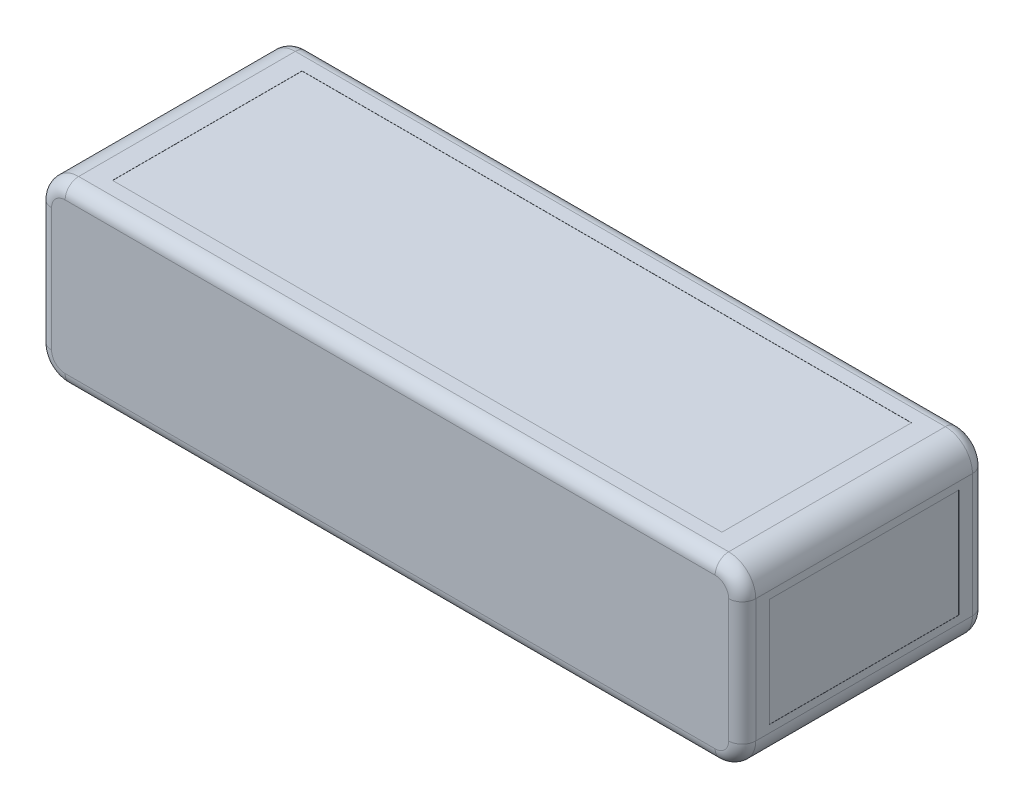
from build123d import *

# Parameters (mm, degrees)
SKETCH1_W           = 52
SKETCH1_H           = 18
BOSS_EXTRUDE1_DEPTH = 6.55
FILLET1_R           = 2
FILLET2_R           = 1
SKETCH2_W           = 45
SKETCH2_H           = 14
CUT_EXTRUDE1_DEPTH  = 0.01
SKETCH3_W           = 14
SKETCH3_H           = 8
CUT_EXTRUDE2_DEPTH  = 0.01


with BuildPart() as part:
    # Sketch1 → Boss-Extrude1 (new, symmetric)
    with BuildSketch(Plane(origin=(0, 0, 0), x_dir=(1, 0, 0), z_dir=(0, 1, 0))):
        Rectangle(SKETCH1_W, SKETCH1_H)
    extrude(amount=BOSS_EXTRUDE1_DEPTH, both=True)

    # Fillet1
    fillet1_edges = [part.edges().sort_by_distance(p)[0] for p in [
        (-26, 6.55, 0),
        (26, 6.55, 0),
        (-26, -6.55, 0),
        (26, -6.55, 0),
    ]]
    fillet(fillet1_edges, radius=FILLET1_R)

    # Fillet2
    fillet2_edges = [part.edges().sort_by_distance(p)[0] for p in [
        (-26, 0, 9),
        (-26, 0, -9),
        (0, -6.55, 9),
        (26, 0, 9),
        (0, 6.55, 9),
        (25.414213562, 5.964213562, 9),
        (25.414213562, -5.964213562, 9),
        (-25.414213562, 5.964213562, 9),
        (-25.414213562, -5.964213562, 9),
        (0, -6.55, -9),
        (0, 6.55, -9),
        (26, 0, -9),
        (25.414213562, 5.964213562, -9),
        (25.414213562, -5.964213562, -9),
        (-25.414213562, 5.964213562, -9),
        (-25.414213562, -5.964213562, -9),
    ]]
    fillet(fillet2_edges, radius=FILLET2_R)

    # Sketch2 → Cut-Extrude1 (cut)
    with BuildSketch(Plane(origin=(0, 6.55, 0), x_dir=(1, 0, 0), z_dir=(0, 1, 0))):
        Rectangle(SKETCH2_W, SKETCH2_H)
    cut_extrude1 = extrude(amount=-CUT_EXTRUDE1_DEPTH, mode=Mode.SUBTRACT)

    # Sketch3 → Cut-Extrude2 (cut)
    with BuildSketch(Plane.ZY.offset(26)):
        Rectangle(SKETCH3_W, SKETCH3_H)
    cut_extrude2 = extrude(amount=-CUT_EXTRUDE2_DEPTH, mode=Mode.SUBTRACT)

    # Mirror3: Cut-Extrude1 across plane
    add(cut_extrude1.mirror(Plane.ZX), mode=Mode.SUBTRACT)

    # Mirror4: Cut-Extrude2 across plane
    add(cut_extrude2.mirror(Plane(origin=(0, 0, 0), x_dir=(0, 0, 1), z_dir=(1, 0, 0))), mode=Mode.SUBTRACT)


solid = part.part
